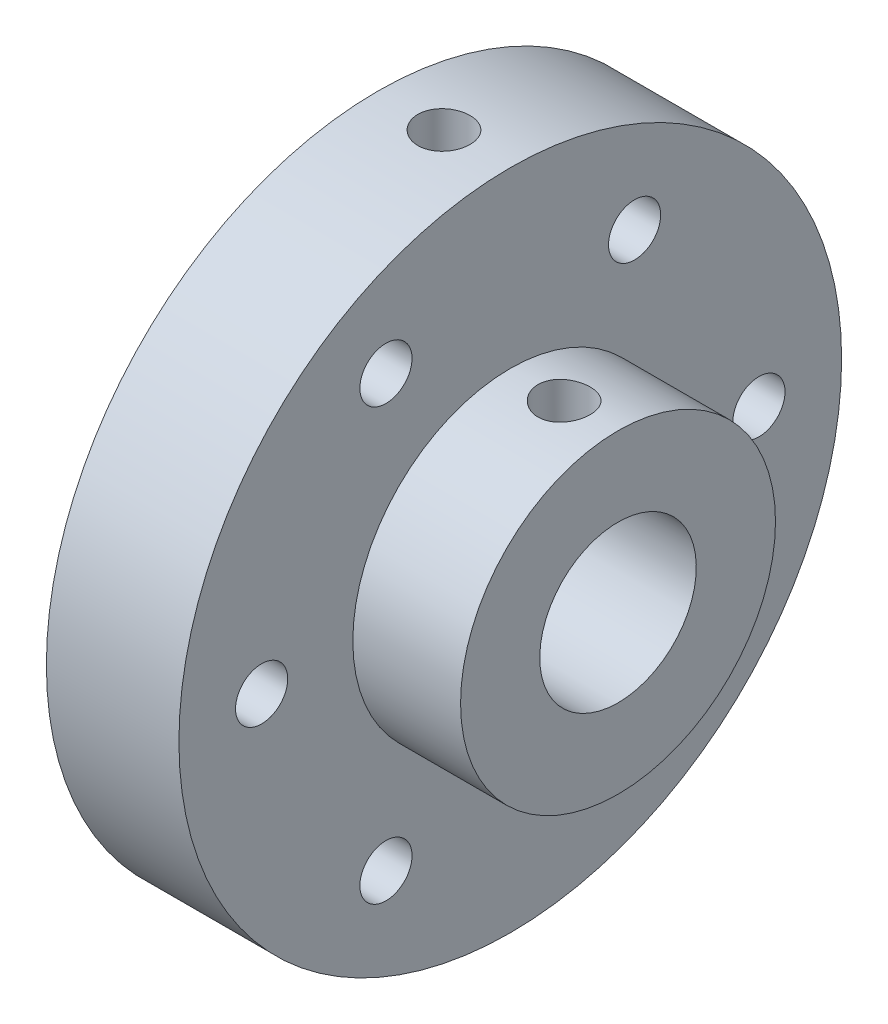
from build123d import *

# Parameters (mm, degrees)
ESQUISSE2_R             = 1
ESQUISSE2_R_2           = 3
ENL_V_MAT_EXTRU_1_DEPTH = 21.184253764
ESQUISSE4_R             = 1
ENL_V_MAT_EXTRU_2_DEPTH = 21.184253764


with BuildPart() as part:
    # Esquisse1 → Révolution1 (revolve)
    with BuildSketch(Plane.XY):
        Polygon((0, 0), (0, 12.7), (5.08, 12.7), (5.08, 6.035), (9.21, 6.035), (9.21, 0), align=None)
    revolve(axis=Axis((9.21, 0, 0), (-1, 0, 0)))

    # Esquisse2 → Enlèv. mat.-Extru.1 (cut, through all)
    with BuildSketch(Plane.ZY):
        with Locations(Location((9.53, 0, 0), (0, 0, 270))):
            Circle(ESQUISSE2_R)
        with Locations(Location((4.765, -8.253222098, 0), (0, 0, 270))):
            Circle(ESQUISSE2_R)
        with Locations(Location((-4.765, -8.253222098, 0), (0, 0, 270))):
            Circle(ESQUISSE2_R)
        with Locations(Location((-9.53, 0, 0), (0, 0, 270))):
            Circle(ESQUISSE2_R)
        with Locations(Location((-4.765, 8.253222098, 0), (0, 0, 270))):
            Circle(ESQUISSE2_R)
        with Locations(Location((4.765, 8.253222098, 0), (0, 0, 270))):
            Circle(ESQUISSE2_R)
        with Locations(Location((0, 0, 0), (0, 0, 270))):
            Circle(ESQUISSE2_R_2)
    extrude(amount=-ENL_V_MAT_EXTRU_1_DEPTH, mode=Mode.SUBTRACT)

    # Esquisse4 → Enlèv. mat.-Extru.2 (cut, through all)
    with BuildSketch(Plane(origin=(0, 0, 0), x_dir=(1, 0, 0), z_dir=(0, 1, 0))):
        with Locations(Location((2.54, 0, 0), (0, 0, 90))):
            Circle(ESQUISSE4_R)
        with Locations(Location((7.145, 0, 0), (0, 0, 90))):
            Circle(ESQUISSE4_R)
    extrude(amount=ENL_V_MAT_EXTRU_2_DEPTH, mode=Mode.SUBTRACT)


solid = part.part
